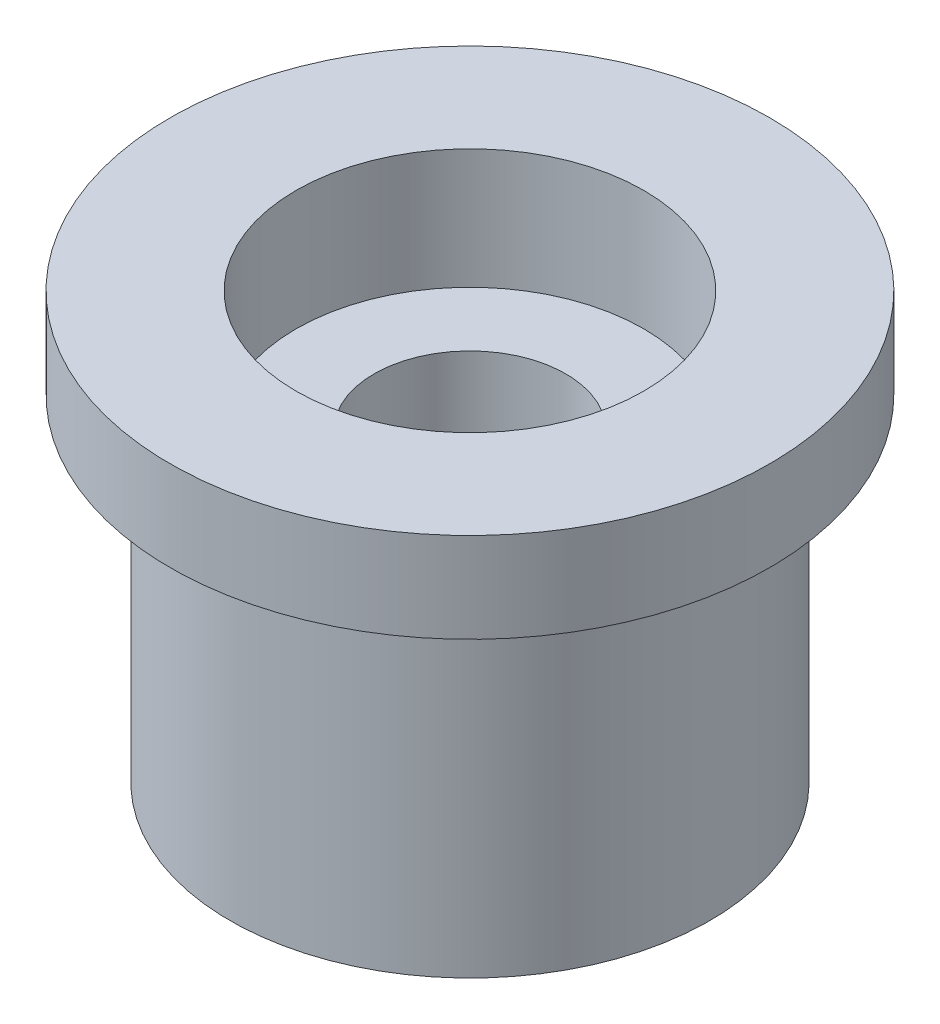
from build123d import *

# Parameters (mm, degrees)
SKETCH1_W                                        = 5
SKETCH1_H                                        = 1.5
SKETCH2_R                                        = 4
BOSS_EXTRUDE1_DEPTH                              = 5.6
CUT_EXTRUDE1_DEPTH                               = 4.3
CUT_EXTRUDE2_DEPTH                               = 4.3
CUT_EXTRUDE3_DEPTH                               = 4.3
CBORE_FOR_M3_HEX_HEAD_MACHINE_SCREW1_D           = 3.2
CBORE_FOR_M3_HEX_HEAD_MACHINE_SCREW1_CBORE_D     = 5.8
CBORE_FOR_M3_HEX_HEAD_MACHINE_SCREW1_CBORE_DEPTH = 2


with BuildPart() as part:
    # Sketch1 → Revolve1 (revolve)
    with BuildSketch(Plane.XY, mode=Mode.PRIVATE) as revolve1_sk:
        with Locations((2.5, 6.35)):
            Rectangle(SKETCH1_W, SKETCH1_H)
    revolve(revolve1_sk.sketch.rotate(Axis((0, 7.1, 0), (0, -1, 0)), 270), axis=Axis((0, 7.1, 0), (0, -1, 0)))

    # Sketch2 → Boss-Extrude1 (add)
    with BuildSketch(Plane.XZ.offset(-5.6)):
        with Locations(Location((0, 0, 0), (0, 0, 270))):
            Circle(SKETCH2_R)
    extrude(amount=BOSS_EXTRUDE1_DEPTH)

    # Sketch3 → Cut-Extrude1 (cut)
    with BuildSketch(Plane.XZ):
        with BuildLine():
            Line((-1.190632453, 2.862235902), (-0.786065004, 2.161504525))
            ThreePointArc((-0.786065004, 2.161504525), (1.15, 1.991858429), (2.264950331, 0.4))
            Line((2.264950331, 0.4), (3.07408523, 0.4))
            ThreePointArc((3.07408523, 0.4), (1.55, 2.684678752), (-1.190632453, 2.862235902))
        make_face()
    extrude(amount=-CUT_EXTRUDE1_DEPTH, mode=Mode.SUBTRACT)

    # Sketch4 → Cut-Extrude2 (cut)
    with BuildSketch(Plane.XZ):
        with BuildLine():
            Line((-0.786065004, -2.161504525), (-1.190632453, -2.862235902))
            ThreePointArc((-1.190632453, -2.862235902), (1.55, -2.684678752), (3.07408523, -0.4))
            Line((3.07408523, -0.4), (2.264950331, -0.4))
            ThreePointArc((2.264950331, -0.4), (1.15, -1.991858429), (-0.786065004, -2.161504525))
        make_face()
    extrude(amount=-CUT_EXTRUDE2_DEPTH, mode=Mode.SUBTRACT)

    # Sketch5 → Cut-Extrude3 (cut)
    with BuildSketch(Plane.XZ):
        with BuildLine():
            Line((-1.883452776, -2.462235902), (-1.478885327, -1.761504525))
            ThreePointArc((-1.478885327, -1.761504525), (-2.3, 0), (-1.478885327, 1.761504525))
            Line((-1.478885327, 1.761504525), (-1.883452776, 2.462235902))
            ThreePointArc((-1.883452776, 2.462235902), (-3.1, 0), (-1.883452776, -2.462235902))
        make_face()
    extrude(amount=-CUT_EXTRUDE3_DEPTH, mode=Mode.SUBTRACT)

    # CBORE for M3 Hex Head Machine Screw1 (through all)
    with Locations(Plane(origin=(0, 7.1, 0), x_dir=(1, 0, 0), z_dir=(0, 1, 0))):
        with Locations((0, 0)):
            CounterBoreHole(CBORE_FOR_M3_HEX_HEAD_MACHINE_SCREW1_D / 2, CBORE_FOR_M3_HEX_HEAD_MACHINE_SCREW1_CBORE_D / 2, CBORE_FOR_M3_HEX_HEAD_MACHINE_SCREW1_CBORE_DEPTH)


solid = part.part
